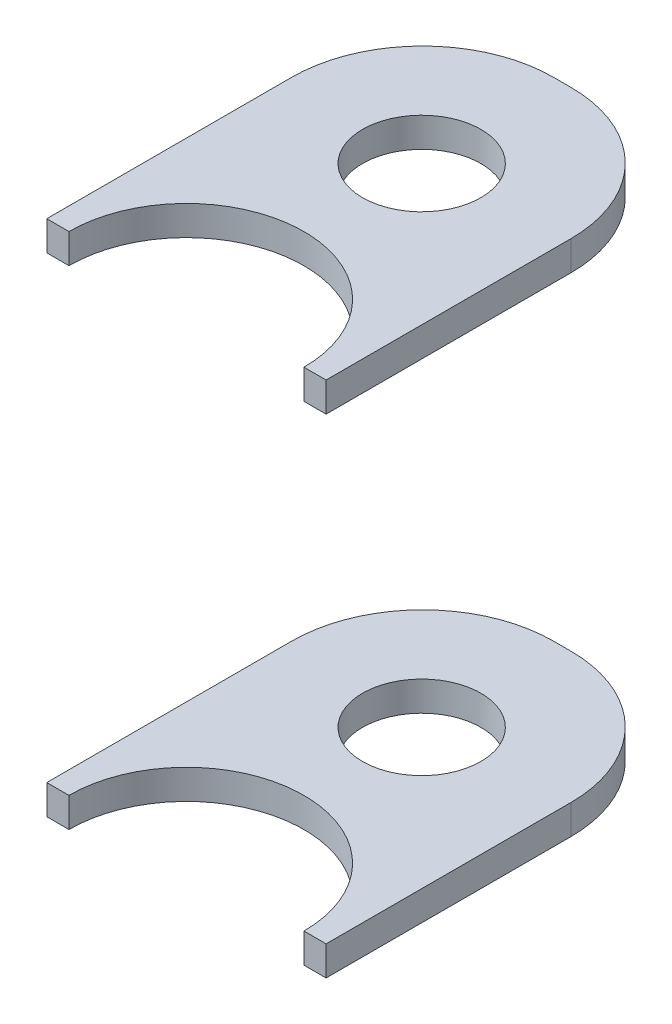
from build123d import *

# Parameters (mm, degrees)
SKETCH1_R           = 8
BOSS_EXTRUDE1_DEPTH = 4


with BuildPart() as part:
    # Sketch1 → Boss-Extrude1 (new body)
    with BuildSketch(Plane(origin=(0, 31, 0), x_dir=(1, 0, 0), z_dir=(0, 1, 0))):
        with BuildLine():
            Line((18.88, -31.8), (15.88, -31.8))
            ThreePointArc((15.88, -31.8), (0, -15.92), (-15.88, -31.8))
            Line((-15.88, -31.8), (-18.88, -31.8))
            Line((-18.88, -31.8), (-18.88, 1.301))
            ThreePointArc((-18.88, 1.301), (-13.69608292, 13.81608292), (-1.181, 19))
            Line((-1.181, 19), (1.181, 19))
            ThreePointArc((1.181, 19), (13.69608292, 13.81608292), (18.88, 1.301))
            Line((18.88, 1.301), (18.88, -31.8))
        make_face()
        Circle(SKETCH1_R, mode=Mode.SUBTRACT)
    extrude(amount=BOSS_EXTRUDE1_DEPTH)


with BuildPart() as body_2:
    # Mirror1: mirrored copy
    add(part.part.mirror(Plane.ZX))


solid = Compound([part.part, body_2.part])
